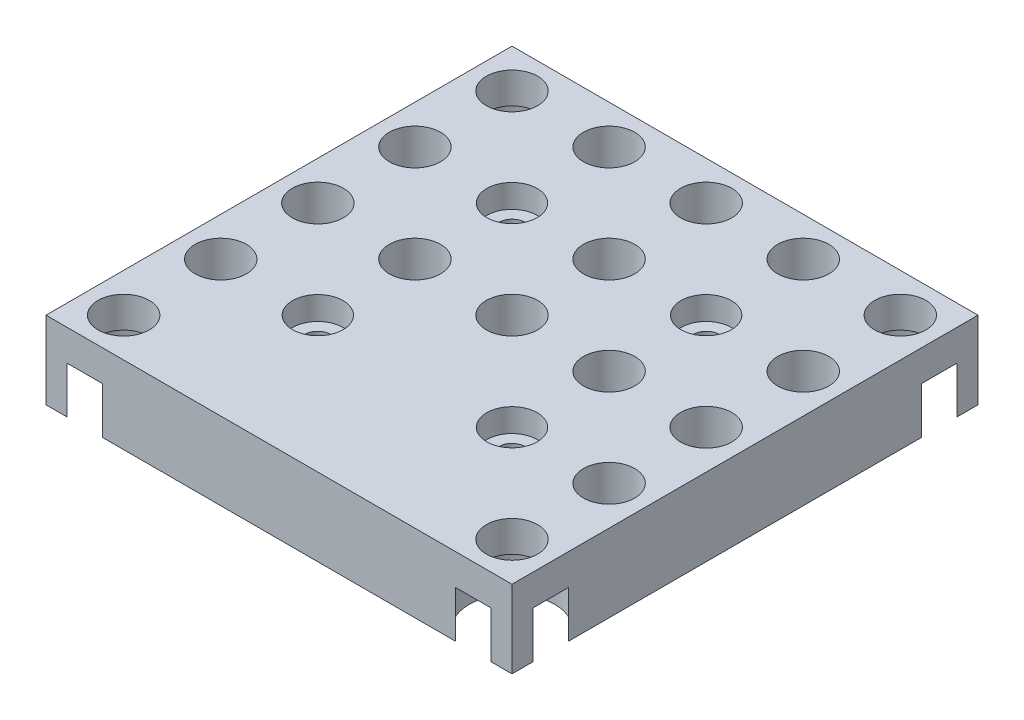
from build123d import *

# Parameters (mm, degrees)
SKETCH1_W                      = 60
SKETCH1_H                      = 60
EXTRUDE1_DEPTH                 = 10
CBORE_FOR_M3_SHCS1_D           = 3.4
CBORE_FOR_M3_SHCS1_CBORE_D     = 6.5
CBORE_FOR_M3_SHCS1_CBORE_DEPTH = 3
LPATTERN2_COUNT                = 2
LPATTERN2_PITCH                = 25
LPATTERN2_COUNT_DIR2           = 2
LPATTERN2_PITCH_DIR2           = 25
CBORE_FOR_M6_SHCS1_D           = 6.6
CBORE_FOR_M6_SHCS1_CBORE_D     = 11
CBORE_FOR_M6_SHCS1_CBORE_DEPTH = 6
LPATTERN3_COUNT                = 2
LPATTERN3_PITCH                = 50
LPATTERN3_COUNT_DIR2           = 2
LPATTERN3_PITCH_DIR2           = 50
LPATTERN5_COUNT                = 2
LPATTERN5_PITCH                = 12.5
LPATTERN5_COL_COUNT            = 2
LPATTERN5_COL_PITCH            = 12.5
LPATTERN6_COUNT                = 2
LPATTERN6_PITCH                = 12.5
LPATTERN7_COUNT                = 2
LPATTERN7_PITCH                = 12.5
LPATTERN7_COL_COUNT            = 2
LPATTERN7_COL_PITCH            = 12.5
LPATTERN8_COUNT                = 3
LPATTERN8_PITCH                = 12.5
LPATTERN9_COUNT                = 2
LPATTERN9_PITCH                = 12.5
LPATTERN9_COL_COUNT            = 2
LPATTERN9_COL_PITCH            = 12.5
LPATTERN10_COUNT               = 2
LPATTERN10_PITCH               = 12.5


with BuildPart() as part:
    # Sketch1 → Extrude1 (new body)
    with BuildSketch(Plane(origin=(0, 0, 0), x_dir=(1, 0, 0), z_dir=(0, 1, 0))):
        Rectangle(SKETCH1_W, SKETCH1_H)
    extrude(amount=EXTRUDE1_DEPTH)

    # CBORE for M3 SHCS1 (through all)
    with Locations(Plane(origin=(-12.5, 10, -12.5), x_dir=(0, 0, 1), z_dir=(0, 1, 0))):
        with Locations((0, 0)):
            cbore_for_m3_shcs1 = CounterBoreHole(CBORE_FOR_M3_SHCS1_D / 2, CBORE_FOR_M3_SHCS1_CBORE_D / 2, CBORE_FOR_M3_SHCS1_CBORE_DEPTH)

    # LPattern2: CBORE for M3 SHCS1 2 × 2
    with Locations(*[(j * LPATTERN2_PITCH_DIR2, 0, i * LPATTERN2_PITCH) for i in range(LPATTERN2_COUNT) for j in range(LPATTERN2_COUNT_DIR2) if (i, j) != (0, 0)]):
        add(cbore_for_m3_shcs1, mode=Mode.SUBTRACT)

    # CBORE for M6 SHCS1 (through all)
    with Locations(Plane(origin=(25, 0, -25), x_dir=(0, 0, -1), z_dir=(0, -1, 0))):
        with Locations((0, 0)):
            cbore_for_m6_shcs1 = CounterBoreHole(CBORE_FOR_M6_SHCS1_D / 2, CBORE_FOR_M6_SHCS1_CBORE_D / 2, CBORE_FOR_M6_SHCS1_CBORE_DEPTH)

    # LPattern3: CBORE for M6 SHCS1 2 × 2
    with Locations(*[(-i * LPATTERN3_PITCH, 0, j * LPATTERN3_PITCH_DIR2) for i in range(LPATTERN3_COUNT) for j in range(LPATTERN3_COUNT_DIR2) if (i, j) != (0, 0)]):
        add(cbore_for_m6_shcs1, mode=Mode.SUBTRACT)

    # Sketch7 → M6 Clearance Hole1 (revolve, cut)
    with BuildSketch(Plane(origin=(0, 0, -25), x_dir=(0, 0, -1), z_dir=(1, 0, 0))):
        Polygon((0, 0), (0, 11.982840043), (3.3, 10), (3.3, 0), align=None)
    m6_clearance_hole1 = revolve(axis=Axis((0, -6.35, -25), (0, 1, 0)), mode=Mode.SUBTRACT)

    # LPattern5: M6 Clearance Hole1 ×2
    with Locations(*[(-i * LPATTERN5_PITCH, 0, 0) for i in range(1, LPATTERN5_COUNT)]):
        add(m6_clearance_hole1, mode=Mode.SUBTRACT)

    # LPattern5 col: M6 Clearance Hole1 ×2
    with Locations(*[(i * LPATTERN5_COL_PITCH, 0, 0) for i in range(1, LPATTERN5_COL_COUNT)]):
        add(m6_clearance_hole1, mode=Mode.SUBTRACT)

    # LPattern6: M6 Clearance Hole1 ×2
    with Locations(*[(0, 0, i * LPATTERN6_PITCH) for i in range(1, LPATTERN6_COUNT)]):
        add(m6_clearance_hole1, mode=Mode.SUBTRACT)

    # Sketch9 → M6 Clearance Hole2 (revolve, cut)
    with BuildSketch(Plane(origin=(25, 0, 0), x_dir=(0, 0, -1), z_dir=(1, 0, 0))):
        Polygon((0, 0), (0, 11.982840043), (3.3, 10), (3.3, 0), align=None)
    m6_clearance_hole2 = revolve(axis=Axis((25, -6.35, 0), (0, 1, 0)), mode=Mode.SUBTRACT)

    # LPattern7: M6 Clearance Hole2 ×2
    with Locations(*[(0, 0, i * LPATTERN7_PITCH) for i in range(1, LPATTERN7_COUNT)]):
        add(m6_clearance_hole2, mode=Mode.SUBTRACT)

    # LPattern7 col: M6 Clearance Hole2 ×2
    with Locations(*[(0, 0, -i * LPATTERN7_COL_PITCH) for i in range(1, LPATTERN7_COL_COUNT)]):
        add(m6_clearance_hole2, mode=Mode.SUBTRACT)

    # LPattern8: M6 Clearance Hole2 ×3
    with Locations(*[(-i * LPATTERN8_PITCH, 0, 0) for i in range(1, LPATTERN8_COUNT)]):
        add(m6_clearance_hole2, mode=Mode.SUBTRACT)

    # Sketch10 → M6 Clearance Hole3 (revolve, cut)
    with BuildSketch(Plane(origin=(-25, 0, 0), x_dir=(0, 0, -1), z_dir=(1, 0, 0))):
        Polygon((0, 0), (0, 11.982840043), (3.3, 10), (3.3, 0), align=None)
    m6_clearance_hole3 = revolve(axis=Axis((-25, -6.35, 0), (0, 1, 0)), mode=Mode.SUBTRACT)

    # LPattern9: M6 Clearance Hole3 ×2
    with Locations(*[(0, 0, i * LPATTERN9_PITCH) for i in range(1, LPATTERN9_COUNT)]):
        add(m6_clearance_hole3, mode=Mode.SUBTRACT)

    # LPattern9 col: M6 Clearance Hole3 ×2
    with Locations(*[(0, 0, -i * LPATTERN9_COL_PITCH) for i in range(1, LPATTERN9_COL_COUNT)]):
        add(m6_clearance_hole3, mode=Mode.SUBTRACT)

    # LPattern10: M6 Clearance Hole3 ×2
    with Locations(*[(i * LPATTERN10_PITCH, 0, 0) for i in range(1, LPATTERN10_COUNT)]):
        add(m6_clearance_hole3, mode=Mode.SUBTRACT)


solid = part.part
